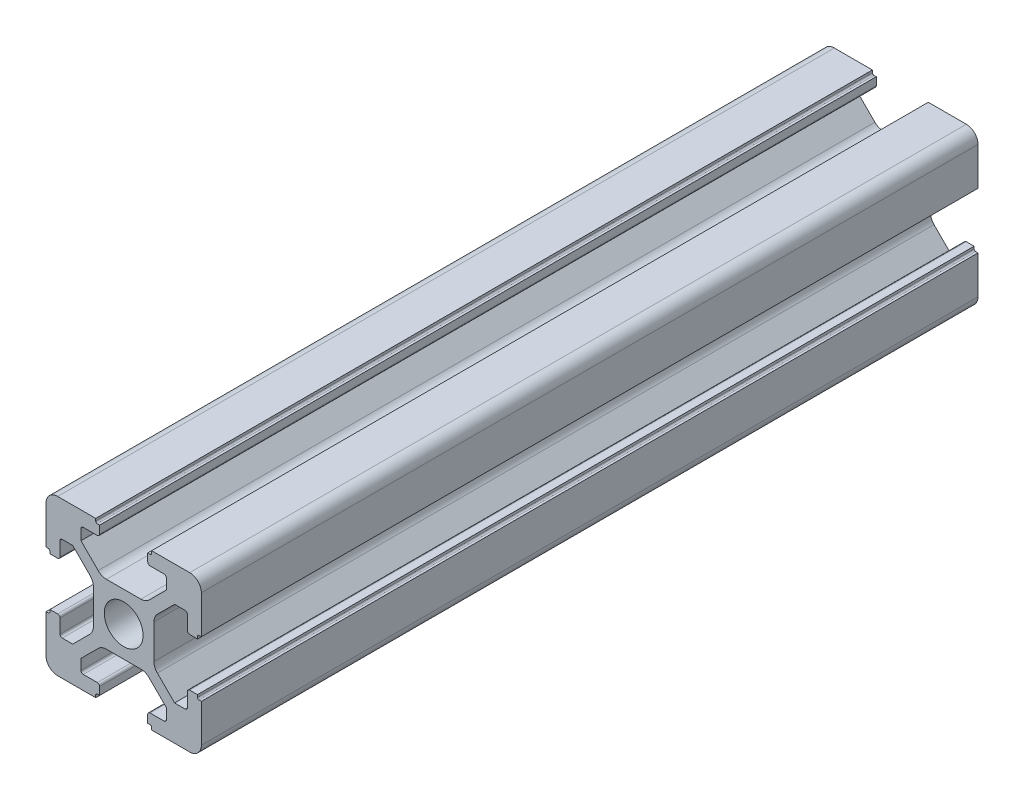
from build123d import *

# Parameters (mm, degrees)
SKETCH_1_R      = 2.5
EXTRUDE_1_DEPTH = 100


with BuildPart() as part:
    # 草图1 → 凸台-拉伸1 (new body)
    with BuildSketch(Plane.XY):
        with BuildLine():
            Line((4.215995631, 3.244230202), (6.436655803, 5.464890373))
            Line((6.436655803, 5.464890373), (7.776655803, 5.464890373))
            ThreePointArc((7.776655803, 5.464890373), (7.988787838, 5.377022408), (8.076655803, 5.164890373))
            Line((8.076655803, 5.164890373), (8.076655803, 3.364890373))
            ThreePointArc((8.076655803, 3.364890373), (8.164523769, 3.152758339), (8.376655803, 3.064890373))
            Line((8.376655803, 3.064890373), (9.376655803, 3.064890373))
            Line((9.376655803, 3.064890373), (9.376655803, 3.364890373))
            ThreePointArc((9.376655803, 3.364890373), (9.435234447, 3.50631173), (9.576655803, 3.564890373))
            Line((9.576655803, 3.564890373), (9.876655803, 3.564890373))
            Line((9.876655803, 3.564890373), (9.876655803, 8.464890373))
            ThreePointArc((9.876655803, 8.464890373), (9.437315975, 9.525550545), (8.376655803, 9.964890373))
            Line((8.376655803, 9.964890373), (3.476655803, 9.964890373))
            Line((3.476655803, 9.964890373), (3.476655803, 9.664890373))
            ThreePointArc((3.476655803, 9.664890373), (3.418077159, 9.523469017), (3.276655803, 9.464890373))
            Line((3.276655803, 9.464890373), (2.976655803, 9.464890373))
            Line((2.976655803, 9.464890373), (2.976655803, 8.464890373))
            ThreePointArc((2.976655803, 8.464890373), (3.064523769, 8.252758339), (3.276655803, 8.164890373))
            Line((3.276655803, 8.164890373), (5.076655803, 8.164890373))
            ThreePointArc((5.076655803, 8.164890373), (5.288787838, 8.077022408), (5.376655803, 7.864890373))
            Line((5.376655803, 7.864890373), (5.376655803, 6.524890373))
            Line((5.376655803, 6.524890373), (3.155995631, 4.304230202))
            ThreePointArc((3.155995631, 4.304230202), (2.669360608, 3.979071075), (2.09533546, 3.864890373))
            Line((2.09533546, 3.864890373), (-2.342023853, 3.864890373))
            ThreePointArc((-2.342023853, 3.864890373), (-2.916049002, 3.979071075), (-3.402684025, 4.304230202))
            Line((-3.402684025, 4.304230202), (-5.623344197, 6.524890373))
            Line((-5.623344197, 6.524890373), (-5.623344197, 7.864890373))
            ThreePointArc((-5.623344197, 7.864890373), (-5.535476231, 8.077022408), (-5.323344197, 8.164890373))
            Line((-5.323344197, 8.164890373), (-3.523344197, 8.164890373))
            ThreePointArc((-3.523344197, 8.164890373), (-3.311212162, 8.252758339), (-3.223344197, 8.464890373))
            Line((-3.223344197, 8.464890373), (-3.223344197, 9.464890373))
            Line((-3.223344197, 9.464890373), (-3.523344197, 9.464890373))
            ThreePointArc((-3.523344197, 9.464890373), (-3.664765553, 9.523469017), (-3.723344197, 9.664890373))
            Line((-3.723344197, 9.664890373), (-3.723344197, 9.964890373))
            Line((-3.723344197, 9.964890373), (-8.623344197, 9.964890373))
            ThreePointArc((-8.623344197, 9.964890373), (-9.684004369, 9.525550545), (-10.123344197, 8.464890373))
            Line((-10.123344197, 8.464890373), (-10.123344197, 3.564890373))
            Line((-10.123344197, 3.564890373), (-9.823344197, 3.564890373))
            ThreePointArc((-9.823344197, 3.564890373), (-9.681922841, 3.50631173), (-9.623344197, 3.364890373))
            Line((-9.623344197, 3.364890373), (-9.623344197, 3.064890373))
            Line((-9.623344197, 3.064890373), (-8.623344197, 3.064890373))
            ThreePointArc((-8.623344197, 3.064890373), (-8.411212162, 3.152758339), (-8.323344197, 3.364890373))
            Line((-8.323344197, 3.364890373), (-8.323344197, 5.164890373))
            ThreePointArc((-8.323344197, 5.164890373), (-8.235476231, 5.377022408), (-8.023344197, 5.464890373))
            Line((-8.023344197, 5.464890373), (-6.683344197, 5.464890373))
            Line((-6.683344197, 5.464890373), (-4.462684025, 3.244230202))
            ThreePointArc((-4.462684025, 3.244230202), (-4.137524898, 2.757595178), (-4.023344197, 2.18357003))
            Line((-4.023344197, 2.18357003), (-4.023344197, -2.253789283))
            ThreePointArc((-4.023344197, -2.253789283), (-4.137524898, -2.827814432), (-4.462684025, -3.314449455))
            Line((-4.462684025, -3.314449455), (-6.683344197, -5.535109627))
            Line((-6.683344197, -5.535109627), (-8.023344197, -5.535109627))
            ThreePointArc((-8.023344197, -5.535109627), (-8.235476231, -5.447241661), (-8.323344197, -5.235109627))
            Line((-8.323344197, -5.235109627), (-8.323344197, -3.435109627))
            ThreePointArc((-8.323344197, -3.435109627), (-8.411212162, -3.222977592), (-8.623344197, -3.135109627))
            Line((-8.623344197, -3.135109627), (-9.623344197, -3.135109627))
            Line((-9.623344197, -3.135109627), (-9.623344197, -3.435109627))
            ThreePointArc((-9.623344197, -3.435109627), (-9.681922841, -3.576530983), (-9.823344197, -3.635109627))
            Line((-9.823344197, -3.635109627), (-10.123344197, -3.635109627))
            Line((-10.123344197, -3.635109627), (-10.123344197, -8.535109627))
            ThreePointArc((-10.123344197, -8.535109627), (-9.684004369, -9.595769798), (-8.623344197, -10.035109627))
            Line((-8.623344197, -10.035109627), (-3.723344197, -10.035109627))
            Line((-3.723344197, -10.035109627), (-3.723344197, -9.735109627))
            ThreePointArc((-3.723344197, -9.735109627), (-3.664765553, -9.59368827), (-3.523344197, -9.535109627))
            Line((-3.523344197, -9.535109627), (-3.223344197, -9.535109627))
            Line((-3.223344197, -9.535109627), (-3.223344197, -8.535109627))
            ThreePointArc((-3.223344197, -8.535109627), (-3.311212162, -8.322977592), (-3.523344197, -8.235109627))
            Line((-3.523344197, -8.235109627), (-5.323344197, -8.235109627))
            ThreePointArc((-5.323344197, -8.235109627), (-5.535476231, -8.147241661), (-5.623344197, -7.935109627))
            Line((-5.623344197, -7.935109627), (-5.623344197, -6.595109627))
            Line((-5.623344197, -6.595109627), (-3.402684025, -4.374449455))
            ThreePointArc((-3.402684025, -4.374449455), (-2.916049002, -4.049290328), (-2.342023853, -3.935109627))
            Line((-2.342023853, -3.935109627), (2.09533546, -3.935109627))
            ThreePointArc((2.09533546, -3.935109627), (2.669360608, -4.049290328), (3.155995631, -4.374449455))
            Line((3.155995631, -4.374449455), (5.376655803, -6.595109627))
            Line((5.376655803, -6.595109627), (5.376655803, -7.935109627))
            ThreePointArc((5.376655803, -7.935109627), (5.288787838, -8.147241661), (5.076655803, -8.235109627))
            Line((5.076655803, -8.235109627), (3.276655803, -8.235109627))
            ThreePointArc((3.276655803, -8.235109627), (3.064523769, -8.322977592), (2.976655803, -8.535109627))
            Line((2.976655803, -8.535109627), (2.976655803, -9.535109627))
            Line((2.976655803, -9.535109627), (3.276655803, -9.535109627))
            ThreePointArc((3.276655803, -9.535109627), (3.418077159, -9.59368827), (3.476655803, -9.735109627))
            Line((3.476655803, -9.735109627), (3.476655803, -10.035109627))
            Line((3.476655803, -10.035109627), (8.376655803, -10.035109627))
            ThreePointArc((8.376655803, -10.035109627), (9.437315975, -9.595769798), (9.876655803, -8.535109627))
            Line((9.876655803, -8.535109627), (9.876655803, -3.635109627))
            Line((9.876655803, -3.635109627), (9.576655803, -3.635109627))
            ThreePointArc((9.576655803, -3.635109627), (9.435234447, -3.576530983), (9.376655803, -3.435109627))
            Line((9.376655803, -3.435109627), (9.376655803, -3.135109627))
            Line((9.376655803, -3.135109627), (8.376655803, -3.135109627))
            ThreePointArc((8.376655803, -3.135109627), (8.164523769, -3.222977592), (8.076655803, -3.435109627))
            Line((8.076655803, -3.435109627), (8.076655803, -5.235109627))
            ThreePointArc((8.076655803, -5.235109627), (7.988787838, -5.447241661), (7.776655803, -5.535109627))
            Line((7.776655803, -5.535109627), (6.436655803, -5.535109627))
            Line((6.436655803, -5.535109627), (4.215995631, -3.314449455))
            ThreePointArc((4.215995631, -3.314449455), (3.890836504, -2.827814432), (3.776655803, -2.253789283))
            Line((3.776655803, -2.253789283), (3.776655803, 2.18357003))
            ThreePointArc((3.776655803, 2.18357003), (3.890836504, 2.757595178), (4.215995631, 3.244230202))
        make_face()
        with Locations((-0.123344197, -0.035109627)):
            Circle(SKETCH_1_R, mode=Mode.SUBTRACT)
    extrude(amount=EXTRUDE_1_DEPTH)


solid = part.part
